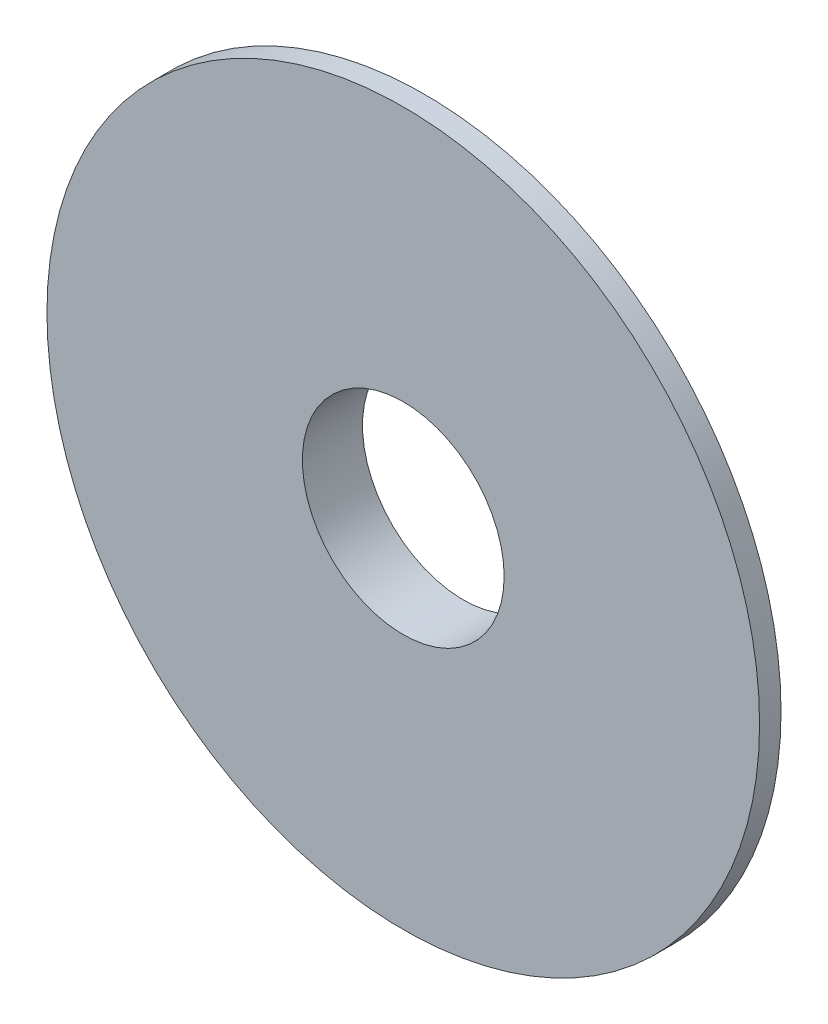
from build123d import *

# Parameters (mm, degrees)
COVER_WEB_START    = 35
SKETCH_1_R         = 83
SKETCH_1_R_2       = 23.5
COVER_WEB_DEPTH    = 5
BEARING_BOSS_START = 26
SKETCH_2_R         = 27.5
SKETCH_2_R_2       = 23.5
BEARING_BOSS_DEPTH = 14


with BuildPart() as part:
    # Эскиз1 → Cover_web (new body)
    with BuildSketch(Plane.XY.offset(COVER_WEB_START)):
        Circle(SKETCH_1_R)
        Circle(SKETCH_1_R_2, mode=Mode.SUBTRACT)
    extrude(amount=COVER_WEB_DEPTH)

    # Эскиз2 → Bearing_boss (add)
    with BuildSketch(Plane.XY.offset(BEARING_BOSS_START)):
        Circle(SKETCH_2_R)
        Circle(SKETCH_2_R_2, mode=Mode.SUBTRACT)
    extrude(amount=BEARING_BOSS_DEPTH)


solid = part.part
